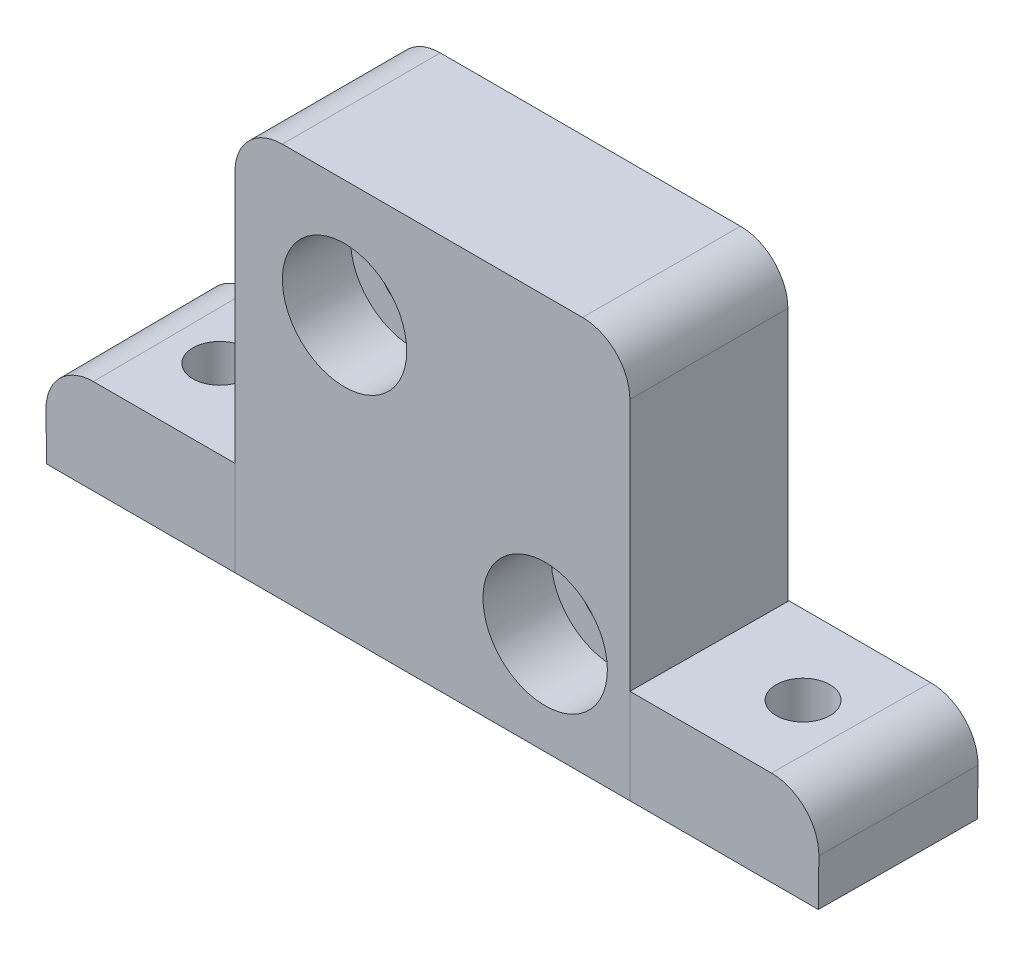
from build123d import *

# Parameters (mm, degrees)
SKETCH1_W           = 25
SKETCH1_H           = 25
SKETCH1_R           = 2.2225
BOSS_EXTRUDE1_DEPTH = 10
SKETCH2_R           = 3.937
CUT_EXTRUDE3_DEPTH  = 4.318
BOSS_EXTRUDE2_DEPTH = 12
FILLET1_R           = 3
CUT_EXTRUDE4_REACH  = 38.454
SKETCH3_R           = 1.7
FILLET2_R           = 3


with BuildPart() as part:
    # Sketch1 → Boss-Extrude1 (new body)
    with BuildSketch(Plane.XY):
        Rectangle(SKETCH1_W, SKETCH1_H)
        with Locations((-5.563, 5.0876)):
            Circle(SKETCH1_R, mode=Mode.SUBTRACT)
        with Locations((7.137, -6.0376)):
            Circle(SKETCH1_R, mode=Mode.SUBTRACT)
    extrude(amount=BOSS_EXTRUDE1_DEPTH)

    # Sketch2 → Cut-Extrude3 (cut)
    with BuildSketch(Plane.XY.offset(10)):
        with Locations((-5.563, 5.0876)):
            Circle(SKETCH2_R)
        with Locations((7.137, -6.0376)):
            Circle(SKETCH2_R)
    extrude(amount=-CUT_EXTRUDE3_DEPTH, mode=Mode.SUBTRACT)

    # 3DSketch1 → Boss-Extrude2 (add, along a direction that is not the sketch's normal)
    with BuildSketch(Plane(origin=(-12.5, -12.5, 0), x_dir=(0, 0.5144957554275265, 0.8574929257125442), z_dir=(-0.999897134802458, -0.012298966175927167, 0.007379379705556298))):
        Polygon((0, 0), (3.086974533, 5.144957554), (11.66190379, 0), (8.574929257, -5.144957554), align=None)
    boss_extrude2 = extrude(amount=BOSS_EXTRUDE2_DEPTH, dir=(-1, 0, 0))

    # Mirror1: Boss-Extrude2 across plane
    add(boss_extrude2.mirror(Plane(origin=(0, 0, 0), x_dir=(0, 0, 1), z_dir=(1, 0, 0))))

    # Fillet1
    fillet1_edges = [part.edges().sort_by_distance(p)[0] for p in [
        (12.5, 12.5, 5),
        (-12.5, 12.5, 5),
    ]]
    fillet(fillet1_edges, radius=FILLET1_R)

    # Cut-Extrude4: up to this plane
    cut_extrude4_end = Plane(origin=(-12.573793797, -6.500453817, 0.00027229), z_dir=(0, 0.9999999989701944, -4.538294048436099e-05))
    # Sketch3 → Cut-Extrude4 (cut, up to the surface)
    with BuildSketch(Plane.XZ.offset(12.5), mode=Mode.PRIVATE) as cut_extrude4_sk1:
        with Locations(Location((-18.462939729, 4.999863855, 0), (0, 0, 270))):
            Circle(SKETCH3_R)
    cut_extrude4_tool1 = split(extrude(cut_extrude4_sk1.sketch, amount=-CUT_EXTRUDE4_REACH, mode=Mode.PRIVATE), bisect_by=cut_extrude4_end, keep=Keep.BOTH, mode=Mode.PRIVATE)
    add(cut_extrude4_tool1.solids().sort_by_distance((-18.46294, -12.5, 4.999864))[0], mode=Mode.SUBTRACT)
    # Sketch3 → Cut-Extrude4 (cut, up to the surface)
    with BuildSketch(Plane.XZ.offset(12.5), mode=Mode.PRIVATE) as cut_extrude4_sk2:
        with Locations(Location((18.462939729, 4.999863855, 0), (0, 0, 270))):
            Circle(SKETCH3_R)
    cut_extrude4_tool2 = split(extrude(cut_extrude4_sk2.sketch, amount=-CUT_EXTRUDE4_REACH, mode=Mode.PRIVATE), bisect_by=cut_extrude4_end, keep=Keep.BOTH, mode=Mode.PRIVATE)
    add(cut_extrude4_tool2.solids().sort_by_distance((18.46294, -12.5, 4.999864))[0], mode=Mode.SUBTRACT)

    # Fillet2
    fillet2_edges = [part.edges().sort_by_distance(p)[0] for p in [
        (-24.536896899, -6.500226909, 5.000136145),
        (24.536896899, -6.500226909, 5.000136145),
    ]]
    fillet(fillet2_edges, radius=FILLET2_R)


solid = part.part
